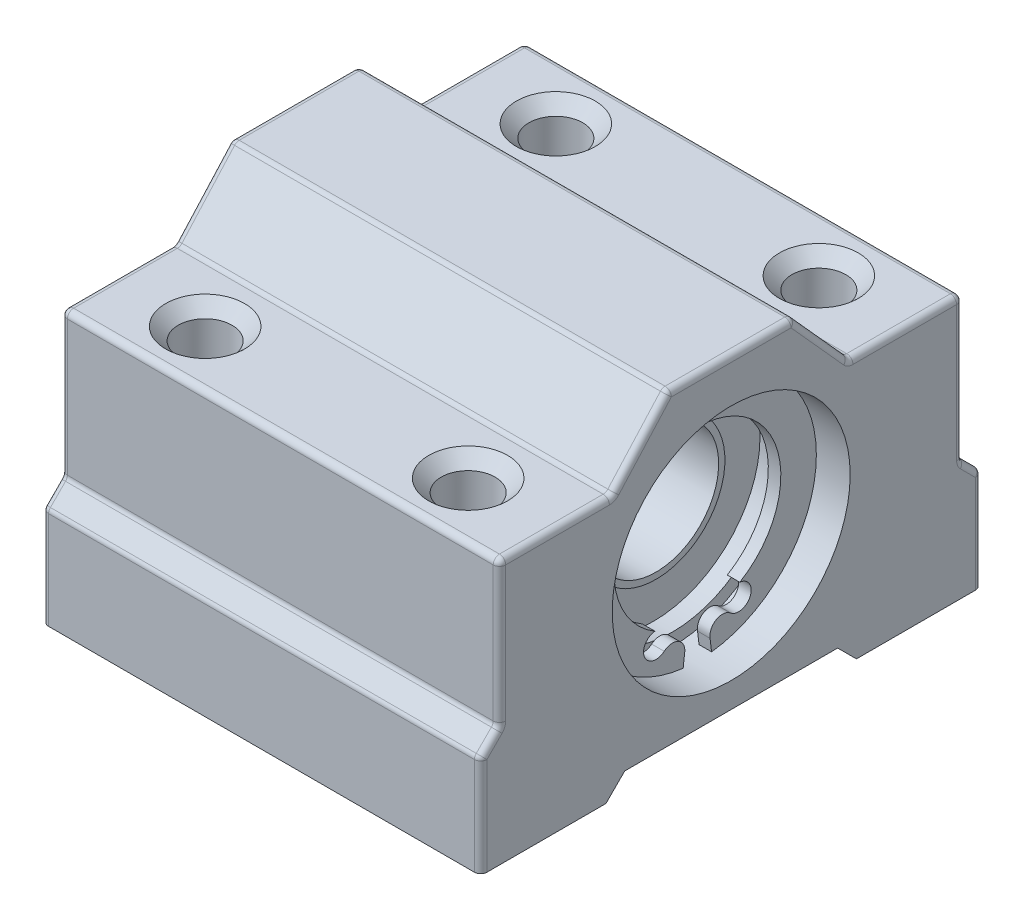
from build123d import *

# Parameters (mm, degrees)
SKETCH1_R           = 9.5
BOSS_EXTRUDE1_DEPTH = 35
EXTRUDE_THIN1_START = 0.5
SKETCH1_4_R         = 5.5
SKETCH1_4_R_2       = 5
EXTRUDE_THIN1_DEPTH = 28.5
BOSS_EXTRUDE2_START = 0.8
SKETCH1_5_R         = 8.5
SKETCH1_5_R_2       = 5
BOSS_EXTRUDE2_DEPTH = 28
BOSS_EXTRUDE3_START = 0.3
SKETCH1_6_R         = 9.5
SKETCH1_6_R_2       = 8.5
BOSS_EXTRUDE3_DEPTH = 30
BOSS_EXTRUDE4_START = 1
BOSS_EXTRUDE4_DEPTH = 1
FILLET1_R           = 0.5
SKETCH4_R           = 2.15
CUT_EXTRUDE3_DEPTH  = 48.968739894
CHAMFER1_SIZE       = 1


with BuildPart() as part:
    # Sketch1 → Boss-Extrude1 (new body)
    with BuildSketch(Plane(origin=(0, 0, 0), x_dir=(0, 0, -1), z_dir=(1, 0, 0))):
        Polygon((-20, -13), (-10, -13), (-8.5, -11.5), (8.5, -11.5), (10, -13), (20, -13), (20, -5), (18.5, -3.5), (18.5, 8), (9.5, 8), (5, 13), (-5, 13), (-9.5, 8), (-18.5, 8), (-18.5, -3.5), (-20, -5), align=None)
        Circle(SKETCH1_R, mode=Mode.SUBTRACT)
    extrude(amount=BOSS_EXTRUDE1_DEPTH)



with BuildPart() as body_2:
    # Sketch1<4> → Extrude-Thin1 (new body)
    with BuildSketch(Plane(origin=(0, 0, 0), x_dir=(0, 0, -1), z_dir=(1, 0, 0)).offset(EXTRUDE_THIN1_START)):
        Circle(SKETCH1_4_R)
        Circle(SKETCH1_4_R_2, mode=Mode.SUBTRACT)
    extrude(amount=EXTRUDE_THIN1_DEPTH)

    # Sketch1<5> → Boss-Extrude2 (add)
    with BuildSketch(Plane(origin=(0, 0, 0), x_dir=(0, 0, -1), z_dir=(1, 0, 0)).offset(BOSS_EXTRUDE2_START)):
        Circle(SKETCH1_5_R)
        Circle(SKETCH1_5_R_2, mode=Mode.SUBTRACT)
    extrude(amount=BOSS_EXTRUDE2_DEPTH)


with BuildPart() as part_1:
    add(part.part)

    add(body_2.part)  # Boss-Extrude3 merges body 2
    # Sketch1<6> → Boss-Extrude3 (add)
    with BuildSketch(Plane(origin=(0, 0, 0), x_dir=(0, 0, -1), z_dir=(1, 0, 0)).offset(BOSS_EXTRUDE3_START)):
        Circle(SKETCH1_6_R)
        Circle(SKETCH1_6_R_2, mode=Mode.SUBTRACT)
    extrude(amount=BOSS_EXTRUDE3_DEPTH)

    # Sketch3 → Boss-Extrude4 (add)
    with BuildSketch(Plane(origin=(30.3, 0, 0), x_dir=(0, 0, -1), z_dir=(1, 0, 0)).offset(BOSS_EXTRUDE4_START)):
        with BuildLine():
            Line((-1.015917942, -8.43907049), (-1.1354377, -9.431902312))
            ThreePointArc((-1.1354377, -9.431902312), (0, 9.5), (1.1354377, -9.431902312))
            Line((1.1354377, -9.431902312), (1.015917942, -8.43907049))
            ThreePointArc((1.015917942, -8.43907049), (1.500925976, -7.394796464), (2.647576922, -7.499355735))
            ThreePointArc((2.647576922, -7.499355735), (4.216931478, -7.125074609), (3.386935643, -5.741576507))
            ThreePointArc((3.386935643, -5.741576507), (0, 6.666110848), (-3.386935643, -5.741576507))
            ThreePointArc((-3.386935643, -5.741576507), (-4.216931478, -7.125074609), (-2.647576922, -7.499355735))
            ThreePointArc((-2.647576922, -7.499355735), (-1.500925976, -7.394796464), (-1.015917942, -8.43907049))
        make_face()
    extrude(amount=BOSS_EXTRUDE4_DEPTH)

    # Fillet1
    fillet1_edges = [part_1.edges().sort_by_distance(p)[0] for p in [
        (17.5, -3.5, -18.5),
        (17.5, -3.5, 18.5),
        (17.5, -5, 20),
        (17.5, -5, -20),
        (17.5, 8, -9.5),
        (17.5, 8, 9.5),
        (17.5, 13, 5),
        (17.5, 13, -5),
        (17.5, 8, -18.5),
        (17.5, 8, 18.5),
        (35, 10.5, -7.25),
        (35, 10.5, 7.25),
        (35, 2.25, 18.5),
        (0, -4.25, 19.25),
        (0, 10.5, 7.25),
        (35, -4.25, -19.25),
        (35, -9, -20),
        (35, 2.25, -18.5),
        (35, 13, 0),
        (35, 8, -14),
        (35, 8, 14),
        (35, -4.25, 19.25),
        (35, -9, 20),
        (0, -9, -20),
        (0, -4.25, -19.25),
        (0, 2.25, -18.5),
        (0, 10.5, -7.25),
        (0, 8, -14),
        (0, 13, 0),
        (0, -9, 20),
        (0, 2.25, 18.5),
        (0, 8, 14),
    ]]
    fillet(fillet1_edges, radius=FILLET1_R)

    # Sketch4 → Cut-Extrude3 (cut, through all)
    with BuildSketch(Plane.XZ.offset(13)):
        with Locations((7, 14)):
            Circle(SKETCH4_R)
        with Locations((28, 14)):
            Circle(SKETCH4_R)
        with Locations((28, -14)):
            Circle(SKETCH4_R)
        with Locations((7, -14)):
            Circle(SKETCH4_R)
    extrude(amount=-CUT_EXTRUDE3_DEPTH, mode=Mode.SUBTRACT)

    # Chamfer1
    chamfer1_edges = [part_1.edges().sort_by_distance(p)[0] for p in [
        (25.85, 8, -14),
        (4.85, 8, -14),
        (4.85, 8, 14),
        (25.85, 8, 14),
        (25.85, -13, 14),
        (4.85, -13, 14),
    ]]
    chamfer(chamfer1_edges, length=CHAMFER1_SIZE)


solid = part_1.part
